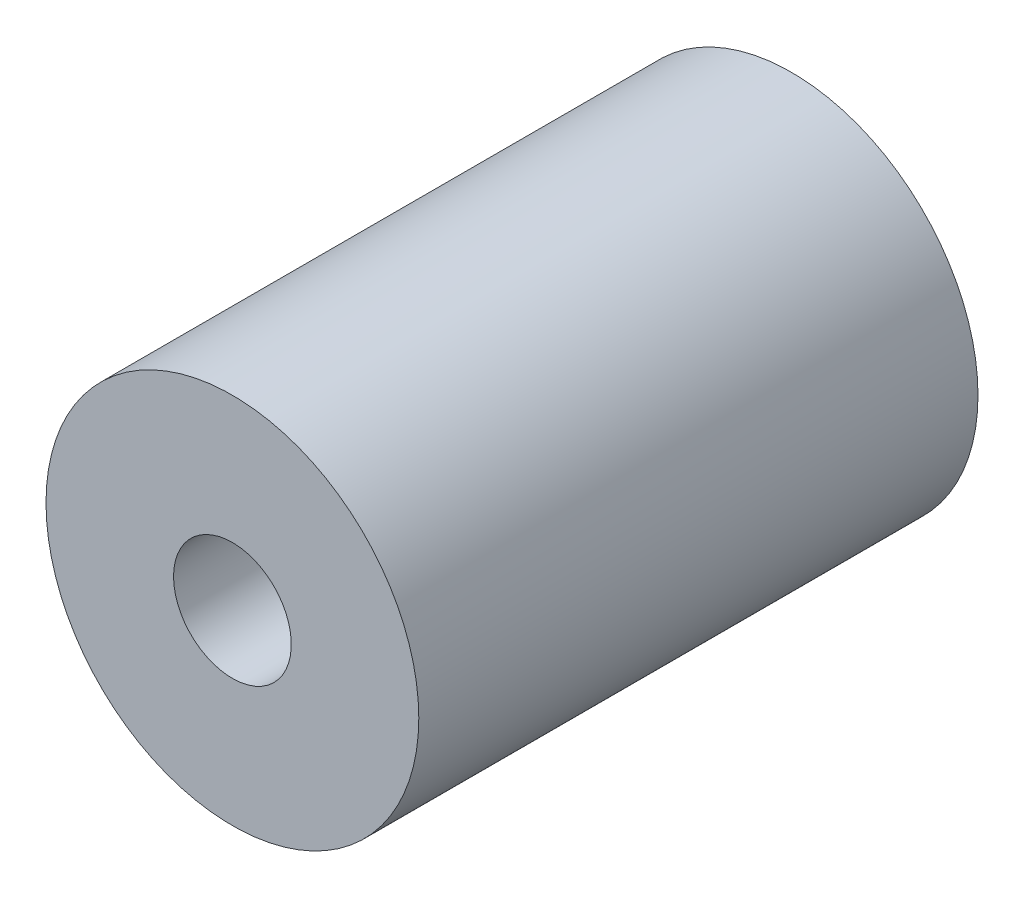
from build123d import *

# Parameters (mm, degrees)
SKETCH1_R           = 19
SKETCH1_R_2         = 6
BOSS_EXTRUDE1_DEPTH = 28.5


with BuildPart() as part:
    # Sketch1 → Boss-Extrude1 (new, symmetric)
    with BuildSketch(Plane.XY):
        with Locations(Location((0, 0, 0), (0, 0, 180))):
            Circle(SKETCH1_R)
        with Locations(Location((0, 0, 0), (0, 0, 180))):
            Circle(SKETCH1_R_2, mode=Mode.SUBTRACT)
    extrude(amount=BOSS_EXTRUDE1_DEPTH, both=True)


solid = part.part
